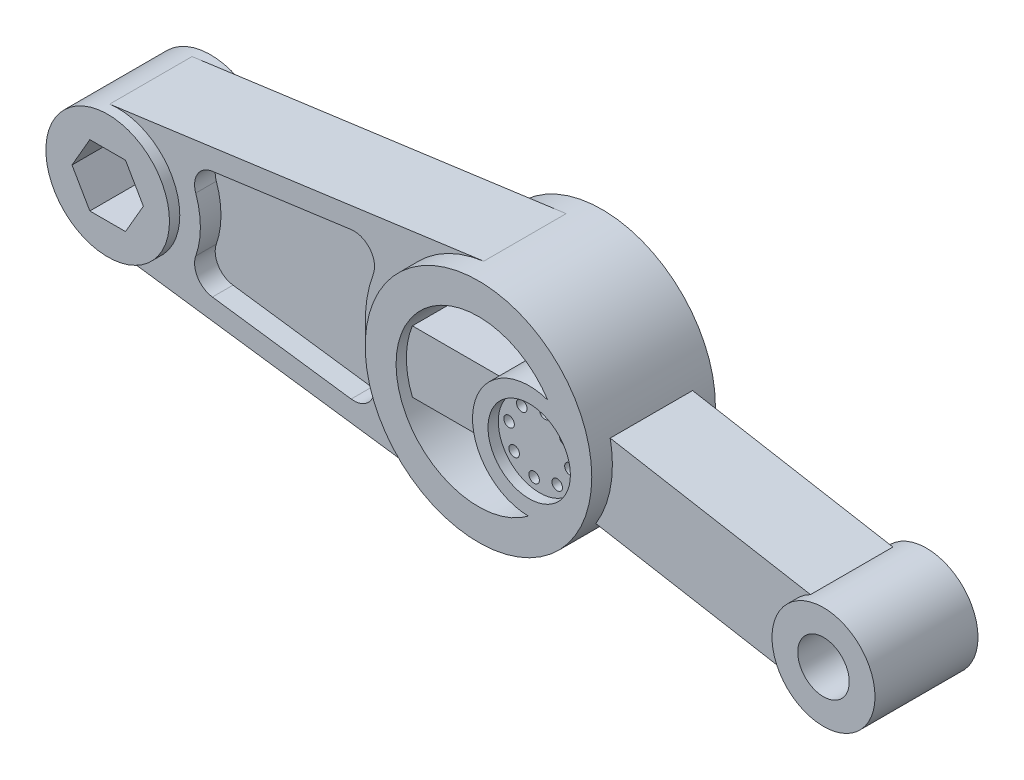
from build123d import *
from build123d.topology import SkipClean

# Parameters (mm, degrees)
LEFT_ARM_DEPTH                = 20
SKETCH2_R                     = 30
LEFT_BOSS_DEPTH               = 25
LEFT_HEX_DEPTH                = 252.246891
LEFT_HEX_DEPTH_BACK           = 252.246891
SKETCH3_R                     = 55
CENTRE_BOSS_DEPTH             = 30
SKETCH5_W                     = 40
SKETCH5_H                     = 40
RIGHT_ARM_DEPTH               = 165
SKETCH7_R                     = 25
RIGHT_BOSS_DEPTH              = 25
SKETCH8_R                     = 12.5
RIGHT_BOSS_HOLE_DEPTH         = 381.527585
SKETCH9_R                     = 40
CENTRE_HOLE_DEPTH             = 382.282367
SKETCH10_R                    = 27.5
CENTRE_BLOB_DEPTH             = 30
CENTRE_BEAM_REACH             = 225.942
SKETCH11_W                    = 50
SKETCH11_H                    = 30
CENTRE_BEAM_DIRECTION_2_REACH = 225.942
SKETCH12_R                    = 20
CUT_EXTRUDE4_DEPTH            = 5
F_1_4_20_TAPPED_HOLE1_D       = 5.1054
CIRPATTERN1_COUNT             = 8
CUT_OUT_DEPTH                 = 10
FILLET1_R                     = 10
FILLET1_OF_MIRROR2_R          = 10


with BuildPart() as part:
    # Sketch1 → LEFT_ARM (new, symmetric)
    with BuildSketch(Plane.XY):
        with BuildLine():
            Line((-4.054054, 29.724815), (177.567568, 54.495495))
            ThreePointArc((177.567568, 54.495495), (240, 0), (177.567568, -54.495495))
            Line((177.567568, -54.495495), (-4.054054, -29.724815))
            ThreePointArc((-4.054054, -29.724815), (-30, 0), (-4.054054, 29.724815))
        make_face()
    extrude(amount=LEFT_ARM_DEPTH, both=True)

    # Sketch2 → LEFT_Boss (add, symmetric)
    with SkipClean():  # the faces are left unmerged after this step: merging them gives an invalid solid
        with BuildSketch(Plane.XY):
            Circle(SKETCH2_R)
        extrude(amount=LEFT_BOSS_DEPTH, both=True)

    # Sketch4 → LEFT_Hex (cut, two sides: drawn at the far end of the back side and taken through both)
    with SkipClean():  # the faces are left unmerged after this step: merging them gives an invalid solid
        with BuildSketch(Plane.XY.offset(25).offset(-LEFT_HEX_DEPTH_BACK)):
            Polygon((17.320508, 0), (8.660254, 15), (-8.660254, 15), (-17.320508, 0), (-8.660254, -15), (8.660254, -15), align=None)
        extrude(amount=LEFT_HEX_DEPTH + LEFT_HEX_DEPTH_BACK, mode=Mode.SUBTRACT)

    # Sketch3 → CENTRE_Boss (add, symmetric)
    with BuildSketch(Plane.XY):
        with Locations((185, 0)):
            Circle(SKETCH3_R)
    extrude(amount=CENTRE_BOSS_DEPTH, both=True)

    # Sketch5 → RIGHT_ARM (add)
    with BuildSketch(Plane(origin=(179.421567, -31.636863, 0), x_dir=(0, 0, -1), z_dir=(0.984807753012208, -0.17364817766693072, 0))):
        with Locations((0, 32.124913)):
            Rectangle(SKETCH5_W, SKETCH5_H)
    extrude(amount=RIGHT_ARM_DEPTH)

    # Sketch7 → RIGHT_Boss (add, symmetric)
    with BuildSketch(Plane.XY):
        with Locations((347.493279, -28.651949)):
            Circle(SKETCH7_R)
    extrude(amount=RIGHT_BOSS_DEPTH, both=True)

    # Sketch8 → RIGHT_Boss_Hole (cut, through all)
    with BuildSketch(Plane.XY.offset(25)):
        with Locations((347.493279, -28.651949)):
            Circle(SKETCH8_R)
    extrude(amount=-RIGHT_BOSS_HOLE_DEPTH, mode=Mode.SUBTRACT)

    # Sketch9 → CENTRE_Hole (cut, through all)
    with BuildSketch(Plane.XY.offset(30)):
        with Locations((185, 0)):
            Circle(SKETCH9_R)
    extrude(amount=-CENTRE_HOLE_DEPTH, mode=Mode.SUBTRACT)

    # Sketch10 → CENTRE_Blob (add, symmetric)
    with BuildSketch(Plane.XY):
        with Locations((209.620194, -4.341204)):
            Circle(SKETCH10_R)
    extrude(amount=CENTRE_BLOB_DEPTH, both=True)

    # Sketch11 → CENTRE_Beam (add, up to next)
    with BuildSketch(Plane(origin=(185, 0, 0), x_dir=(0, 0, -1), z_dir=(1, 0, 0)), mode=Mode.PRIVATE) as centre_beam_sk1:
        Rectangle(SKETCH11_W, SKETCH11_H)
    centre_beam_tool1 = extrude(centre_beam_sk1.sketch, amount=CENTRE_BEAM_REACH, mode=Mode.PRIVATE) - part.part
    add(centre_beam_tool1.solids().sort_by_distance((185, 0, 0))[0])

    # Sketch11 → CENTRE_Beam direction 2 (add, up to next)
    with BuildSketch(Plane(origin=(185, 0, 0), x_dir=(0, 0, -1), z_dir=(1, 0, 0)), mode=Mode.PRIVATE) as centre_beam_direction_2_sk1:
        Rectangle(SKETCH11_W, SKETCH11_H)
    centre_beam_direction_2_tool1 = extrude(centre_beam_direction_2_sk1.sketch, amount=-CENTRE_BEAM_DIRECTION_2_REACH, mode=Mode.PRIVATE) - part.part
    add(centre_beam_direction_2_tool1.solids().sort_by_distance((185, 0, 0))[0])

    # Sketch12 → Cut-Extrude4 (cut)
    with BuildSketch(Plane.XY.offset(30)):
        with Locations((209.620194, -4.341204)):
            Circle(SKETCH12_R)
    cut_extrude4 = extrude(amount=-CUT_EXTRUDE4_DEPTH, mode=Mode.SUBTRACT)

    # 1/4-20 Tapped Hole1 (through all)
    with Locations(Plane.XY.offset(25)):
        with Locations((194.848078, -1.736482)):
            f_1_4_20_tapped_hole1 = Hole(F_1_4_20_TAPPED_HOLE1_D / 2)

    # CirPattern1: 1/4-20 Tapped Hole1 ×8 about axis
    cirpattern1_axis = Axis((209.620194, -4.341204, 0), (0, 0, 1))
    for i in range(1, CIRPATTERN1_COUNT):
        add(f_1_4_20_tapped_hole1.rotate(cirpattern1_axis, i * 360 / CIRPATTERN1_COUNT), mode=Mode.SUBTRACT)

    # Mirror1: Cut-Extrude4 across plane
    add(cut_extrude4.mirror(Plane.XY), mode=Mode.SUBTRACT)

    # Sketch15 → Cut_OUT (cut)
    with BuildSketch(Plane.XY.offset(20)):
        with BuildLine():
            Line((132.445005, 38.248823), (31.620558, 24.497762))
            ThreePointArc((31.620558, 24.497762), (40, 0), (31.620558, -24.497762))
            Line((31.620558, -24.497762), (132.445005, -38.248823))
            ThreePointArc((132.445005, -38.248823), (120, 0), (132.445005, 38.248823))
        make_face()
    cut_out = extrude(amount=-CUT_OUT_DEPTH, mode=Mode.SUBTRACT)

    # Fillet1
    fillet1_edges = [part.edges().sort_by_distance(p)[0] for p in [
        (31.620558, -24.497762, 15),
        (31.620558, 24.497762, 15),
        (132.445005, 38.248823, 15),
        (132.445005, -38.248823, 15),
    ]]
    fillet(fillet1_edges, radius=FILLET1_R)

    # Mirror2: Cut_OUT across plane
    with SkipClean():  # the faces are left unmerged after this step: merging them gives an invalid solid
        add(cut_out.mirror(Plane.XY), mode=Mode.SUBTRACT)

    # Fillet1 of Mirror2
    fillet1_of_mirror2_edges = [part.edges().sort_by_distance(p)[0] for p in [
        (31.620558, -24.497762, -15),
        (31.620558, 24.497762, -15),
        (132.445005, 38.248823, -15),
        (132.445005, -38.248823, -15),
    ]]
    fillet(fillet1_of_mirror2_edges, radius=FILLET1_OF_MIRROR2_R)


solid = part.part
